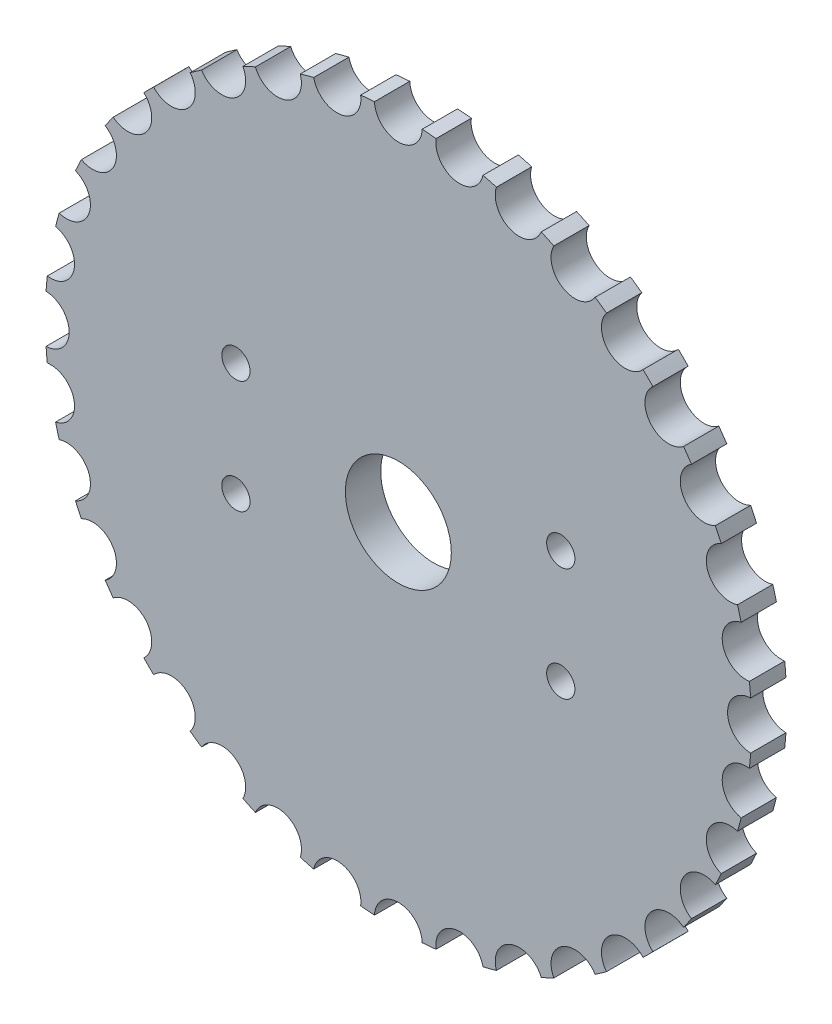
from build123d import *

# Parameters (mm, degrees)
SKETCH_1_R          = 50
EXTRUDE_1_DEPTH     = 5
SKETCH_4_R          = 7.5
CUT_EXTRUDE_3_DEPTH = 10
SKETCH_5_R          = 2
CUT_EXTRUDE_4_DEPTH = 10
SKETCH_6_R          = 3.38
CUT_EXTRUDE_5_DEPTH = 71.887234394


with BuildPart() as part:
    # 스케치1 → 보스-돌출1 (new body)
    with BuildSketch(Plane.XY):
        Circle(SKETCH_1_R)
    extrude(amount=EXTRUDE_1_DEPTH)

    # 스케치4 → 컷-돌출3 (cut)
    with BuildSketch(Plane.XY.offset(5)):
        Circle(SKETCH_4_R)
    extrude(amount=-CUT_EXTRUDE_3_DEPTH, mode=Mode.SUBTRACT)

    # 스케치5 → 컷-돌출4 (cut)
    with BuildSketch(Plane.XY.offset(5)):
        with Locations((-23, 8)):
            Circle(SKETCH_5_R)
        with Locations((23, 8)):
            Circle(SKETCH_5_R)
        with Locations((23, -8)):
            Circle(SKETCH_5_R)
        with Locations((-23, -8)):
            Circle(SKETCH_5_R)
    extrude(amount=-CUT_EXTRUDE_4_DEPTH, mode=Mode.SUBTRACT)

    # 스케치6 → 컷-돌출5 (cut, through all)
    with BuildSketch(Plane.XY.offset(5)):
        with Locations((0, 50)):
            Circle(SKETCH_6_R)
        with Locations((8.682408883, 49.240387651)):
            Circle(SKETCH_6_R)
        with Locations((17.101007166, 46.984631039)):
            Circle(SKETCH_6_R)
        with Locations((25, 43.301270189)):
            Circle(SKETCH_6_R)
        with Locations((32.139380484, 38.302222156)):
            Circle(SKETCH_6_R)
        with Locations((38.302222156, 32.139380484)):
            Circle(SKETCH_6_R)
        with Locations((43.301270189, 25)):
            Circle(SKETCH_6_R)
        with Locations((46.984631039, 17.101007166)):
            Circle(SKETCH_6_R)
        with Locations((49.240387651, 8.682408883)):
            Circle(SKETCH_6_R)
        with Locations((50, 0)):
            Circle(SKETCH_6_R)
        with Locations((49.240387651, -8.682408883)):
            Circle(SKETCH_6_R)
        with Locations((46.984631039, -17.101007166)):
            Circle(SKETCH_6_R)
        with Locations((43.301270189, -25)):
            Circle(SKETCH_6_R)
        with Locations((38.302222156, -32.139380484)):
            Circle(SKETCH_6_R)
        with Locations((32.139380484, -38.302222156)):
            Circle(SKETCH_6_R)
        with Locations((25, -43.301270189)):
            Circle(SKETCH_6_R)
        with Locations((17.101007166, -46.984631039)):
            Circle(SKETCH_6_R)
        with Locations((8.682408883, -49.240387651)):
            Circle(SKETCH_6_R)
        with Locations((0, -50)):
            Circle(SKETCH_6_R)
        with Locations((-8.682408883, -49.240387651)):
            Circle(SKETCH_6_R)
        with Locations((-17.101007166, -46.984631039)):
            Circle(SKETCH_6_R)
        with Locations((-25, -43.301270189)):
            Circle(SKETCH_6_R)
        with Locations((-32.139380484, -38.302222156)):
            Circle(SKETCH_6_R)
        with Locations((-38.302222156, -32.139380484)):
            Circle(SKETCH_6_R)
        with Locations((-43.301270189, -25)):
            Circle(SKETCH_6_R)
        with Locations((-46.984631039, -17.101007166)):
            Circle(SKETCH_6_R)
        with Locations((-49.240387651, -8.682408883)):
            Circle(SKETCH_6_R)
        with Locations((-50, 0)):
            Circle(SKETCH_6_R)
        with Locations((-49.240387651, 8.682408883)):
            Circle(SKETCH_6_R)
        with Locations((-46.984631039, 17.101007166)):
            Circle(SKETCH_6_R)
        with Locations((-43.301270189, 25)):
            Circle(SKETCH_6_R)
        with Locations((-38.302222156, 32.139380484)):
            Circle(SKETCH_6_R)
        with Locations((-32.139380484, 38.302222156)):
            Circle(SKETCH_6_R)
        with Locations((-25, 43.301270189)):
            Circle(SKETCH_6_R)
        with Locations((-17.101007166, 46.984631039)):
            Circle(SKETCH_6_R)
        with Locations((-8.682408883, 49.240387651)):
            Circle(SKETCH_6_R)
    extrude(amount=-CUT_EXTRUDE_5_DEPTH, mode=Mode.SUBTRACT)


solid = part.part
